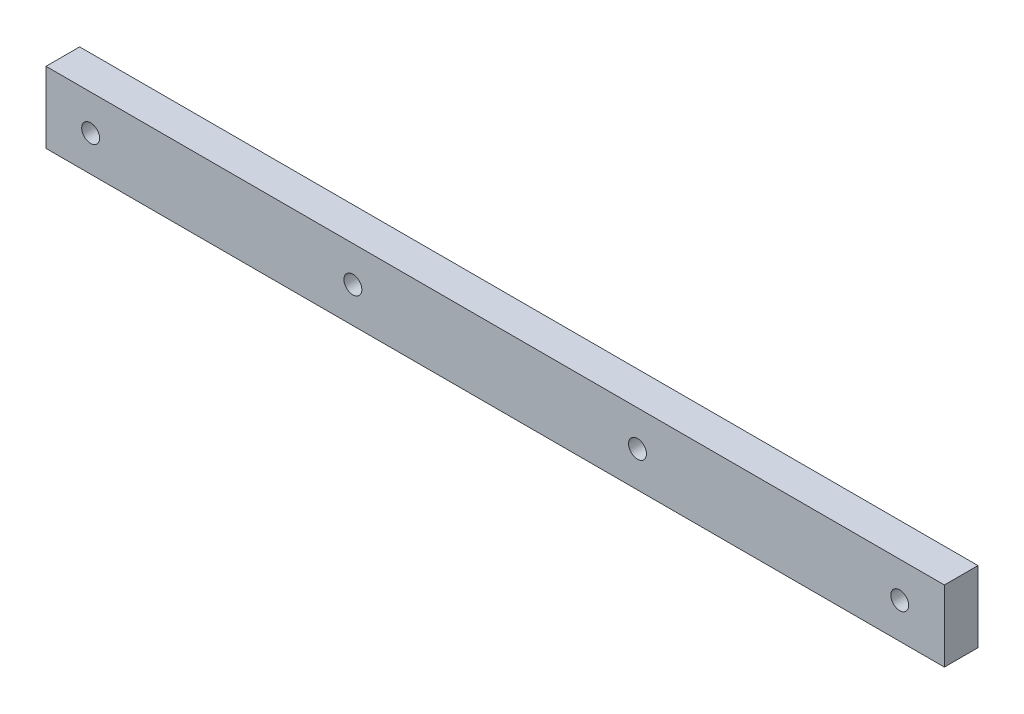
from build123d import *

# Parameters (mm, degrees)
SKETCH1_W           = 160.34
SKETCH1_H           = 12.7
SKETCH1_R           = 1.6
BOSS_EXTRUDE1_DEPTH = 6


with BuildPart() as part:
    # Sketch1 → Boss-Extrude1 (new body)
    with BuildSketch(Plane.XY):
        with Locations((0, 6.35)):
            Rectangle(SKETCH1_W, SKETCH1_H)
        with Locations((-72.2, 6.35)):
            Circle(SKETCH1_R, mode=Mode.SUBTRACT)
        with Locations((72.2, 6.35)):
            Circle(SKETCH1_R, mode=Mode.SUBTRACT)
        with Locations((-25.4, 6.35)):
            Circle(SKETCH1_R, mode=Mode.SUBTRACT)
        with Locations((25.4, 6.35)):
            Circle(SKETCH1_R, mode=Mode.SUBTRACT)
    extrude(amount=BOSS_EXTRUDE1_DEPTH)


solid = part.part
